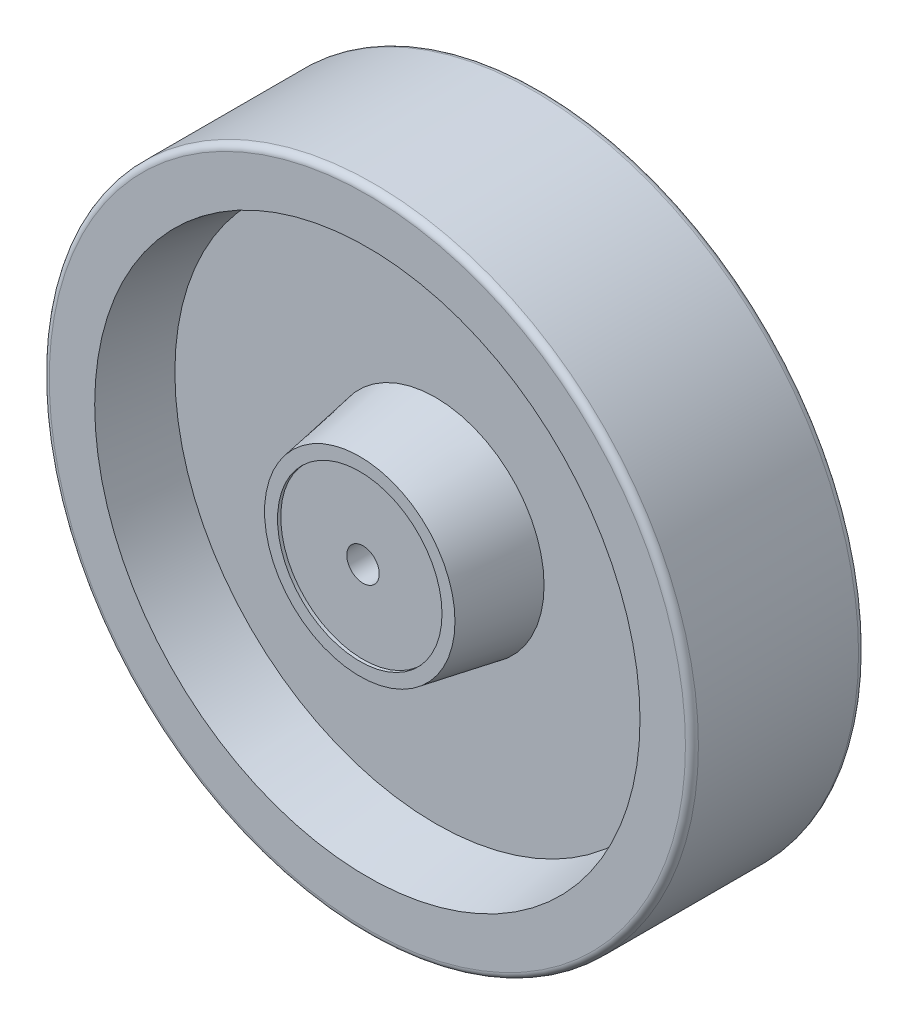
from build123d import *

# Parameters (mm, degrees)
SKETCH1_R           = 150
SKETCH1_R_2         = 138
BOSS_EXTRUDE1_DEPTH = 40
FILLET1_R           = 3
BOSS_EXTRUDE2_DEPTH = 12.5
BOSS_EXTRUDE3_DEPTH = 5.5
SKETCH6_R           = 6.730891085
BOSS_EXTRUDE4_DEPTH = 3
BOSS_EXTRUDE4_TAPER = 30
SKETCH8_R           = 7.5
CUT_EXTRUDE1_DEPTH  = 229.714341483


with BuildPart() as part:
    # Sketch1 → Boss-Extrude1 (new, symmetric)
    with BuildSketch(Plane.XY):
        Circle(SKETCH1_R)
        Circle(SKETCH1_R_2, mode=Mode.SUBTRACT)
    extrude(amount=BOSS_EXTRUDE1_DEPTH, both=True)

    # Fillet1
    fillet1_edges = [part.edges().sort_by_distance(p)[0] for p in [
        (-150, 0, -40),
        (-150, 0, 40),
    ]]
    fillet(fillet1_edges, radius=FILLET1_R)



with BuildPart() as body_2:
    # Sketch2 → Revolve1 (revolve)
    with BuildSketch(Plane(origin=(0, 0, 0), x_dir=(1, 0, 0), z_dir=(0, 1, 0)), mode=Mode.PRIVATE) as revolve1_sk:
        Polygon((0, 42), (0, -42), (-38, -42), (-38, -43.5), (-44, -43.5), (-50.171444325, -8.5), (-120.445700108, -8.5), (-126, -40), (-138, -40), (-138, 40), (-126, 40), (-120.445700108, 8.5), (-50.171444325, 8.5), (-44, 43.5), (-38, 43.5), (-38, 42), align=None)
    revolve(revolve1_sk.sketch.rotate(Axis((0, 0, 0), (0, 0, -1)), 180), axis=Axis((0, 0, 0), (0, 0, -1)))


with BuildPart() as part_1:
    add(part.part)

    add(body_2.part)  # Boss-Extrude2 merges body 2
    # Sketch4 → Boss-Extrude2 (add, symmetric)
    with BuildSketch(Plane(origin=(0, 0, 0), x_dir=(1, 0, 0), z_dir=(0, 1, 0))):
        Polygon((-36.665910449, 28.5), (-36.665910449, 8.5), (-71.665910449, 8.5), (-71.665910449, 11.5), (-39.665910449, 28.5), align=None)
    extrude(amount=BOSS_EXTRUDE2_DEPTH, both=True)

    # Sketch5 → Boss-Extrude3 (add)
    with BuildSketch(Plane(origin=(-20.538802833, 0, -38.661275921), x_dir=(-0.8831157194574106, 0, 0.46915522596174936), z_dir=(-0.4691552259617493, 0, -0.8831157194574105))):
        Polygon((49.851566833, 3.4173178), (43.40179394, 7.754016548), (36.42121621, 4.336698747), (35.890411372, -3.4173178), (42.340184265, -7.754016548), (49.320761995, -4.336698747), align=None)
    extrude(amount=BOSS_EXTRUDE3_DEPTH)

    # Sketch6 → Boss-Extrude4 (add)
    with BuildSketch(Plane(origin=(-23.119156576, 0, -43.518412378), x_dir=(-0.8831157194574103, 0, 0.4691552259617501), z_dir=(-0.4691552259617501, 0, -0.8831157194574103))):
        with Locations((42.870989102, 0)):
            Circle(SKETCH6_R)
    extrude(amount=BOSS_EXTRUDE4_DEPTH, taper=BOSS_EXTRUDE4_TAPER)

    # Sketch7 → Revolve3 (revolve)
    with BuildSketch(Plane(origin=(0, 0, 0), x_dir=(1, 0, 0), z_dir=(0, 1, 0))):
        with BuildLine():
            ThreePointArc((-66.505399661, 33.471675934), (-60.781448215, 33.38765917), (-57.972112211, 28.399842997))
            Line((-57.972112211, 28.399842997), (-62.386666639, 26.054610957))
            Line((-62.386666639, 26.054610957), (-66.505399661, 33.471675934))
        make_face()
    revolve(axis=Axis((-62.386666639, 0, -26.054610957), (-0.4854755142964054, 0, -0.8742502645230602)))

    # Sketch8 → Cut-Extrude1 (cut, through all)
    with BuildSketch(Plane(origin=(0, 0, -42), x_dir=(-1, 0, 0), z_dir=(0, 0, -1))):
        Circle(SKETCH8_R)
    extrude(amount=-CUT_EXTRUDE1_DEPTH, mode=Mode.SUBTRACT)


solid = part_1.part
